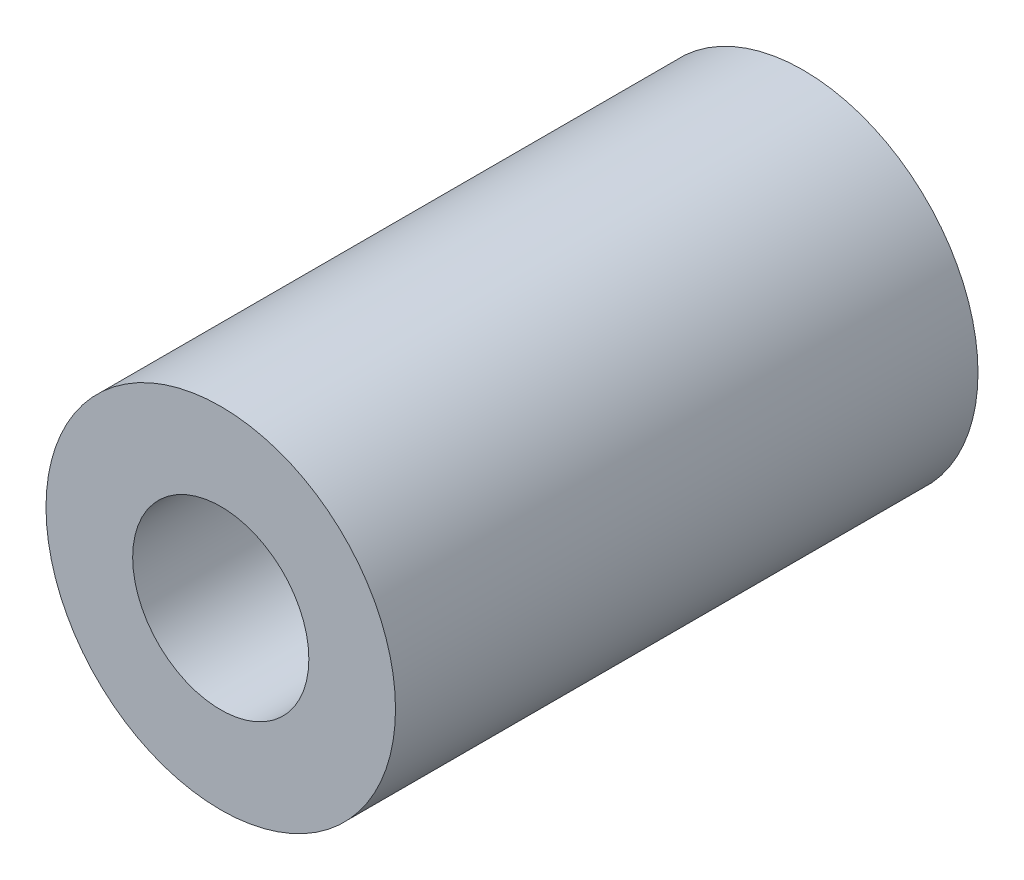
from build123d import *

# Parameters (mm, degrees)
SKETCH1_R           = 6
BOSS_EXTRUDE1_DEPTH = 20
SKETCH2_R           = 4.025
CUT_EXTRUDE1_DEPTH  = 6
SKETCH3_R           = 3.025
CUT_EXTRUDE2_DEPTH  = 15


with BuildPart() as part:
    # Sketch1 → Boss-Extrude1 (new body)
    with BuildSketch(Plane.XY):
        Circle(SKETCH1_R)
    extrude(amount=BOSS_EXTRUDE1_DEPTH)

    # Sketch2 → Cut-Extrude1 (cut)
    with BuildSketch(Plane(origin=(0, 0, 0), x_dir=(-1, 0, 0), z_dir=(0, 0, -1))):
        Circle(SKETCH2_R)
    extrude(amount=-CUT_EXTRUDE1_DEPTH, mode=Mode.SUBTRACT)

    # Sketch3 → Cut-Extrude2 (cut)
    with BuildSketch(Plane.XY.offset(20)):
        Circle(SKETCH3_R)
    extrude(amount=-CUT_EXTRUDE2_DEPTH, mode=Mode.SUBTRACT)


solid = part.part
